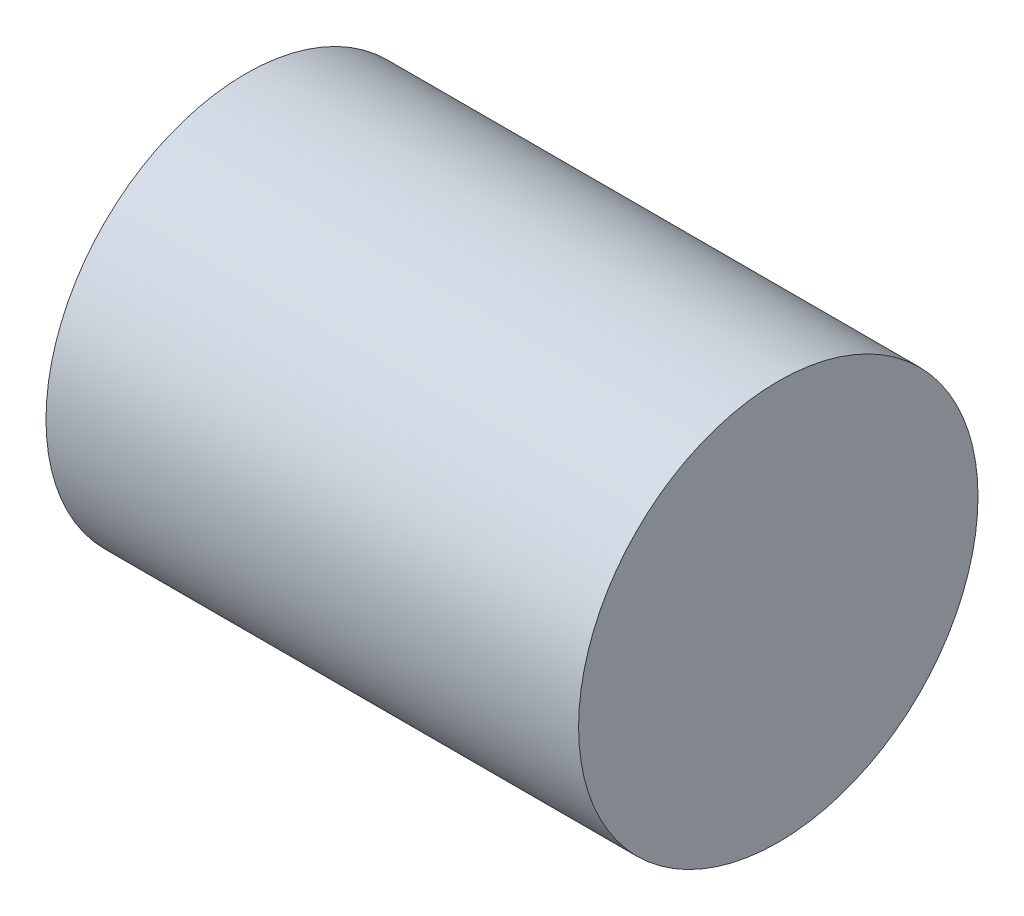
from build123d import *

# Parameters (mm, degrees)
SKIZZE1_R                       = 4.5
AUFSATZ_LINEAR_AUSTRAGEN1_DEPTH = 12


with BuildPart() as part:
    # Skizze1 → Aufsatz-Linear austragen1 (new body)
    with BuildSketch(Plane(origin=(0, 0, 0), x_dir=(0, 0, -1), z_dir=(1, 0, 0))):
        Circle(SKIZZE1_R)
    extrude(amount=-AUFSATZ_LINEAR_AUSTRAGEN1_DEPTH)


solid = part.part
